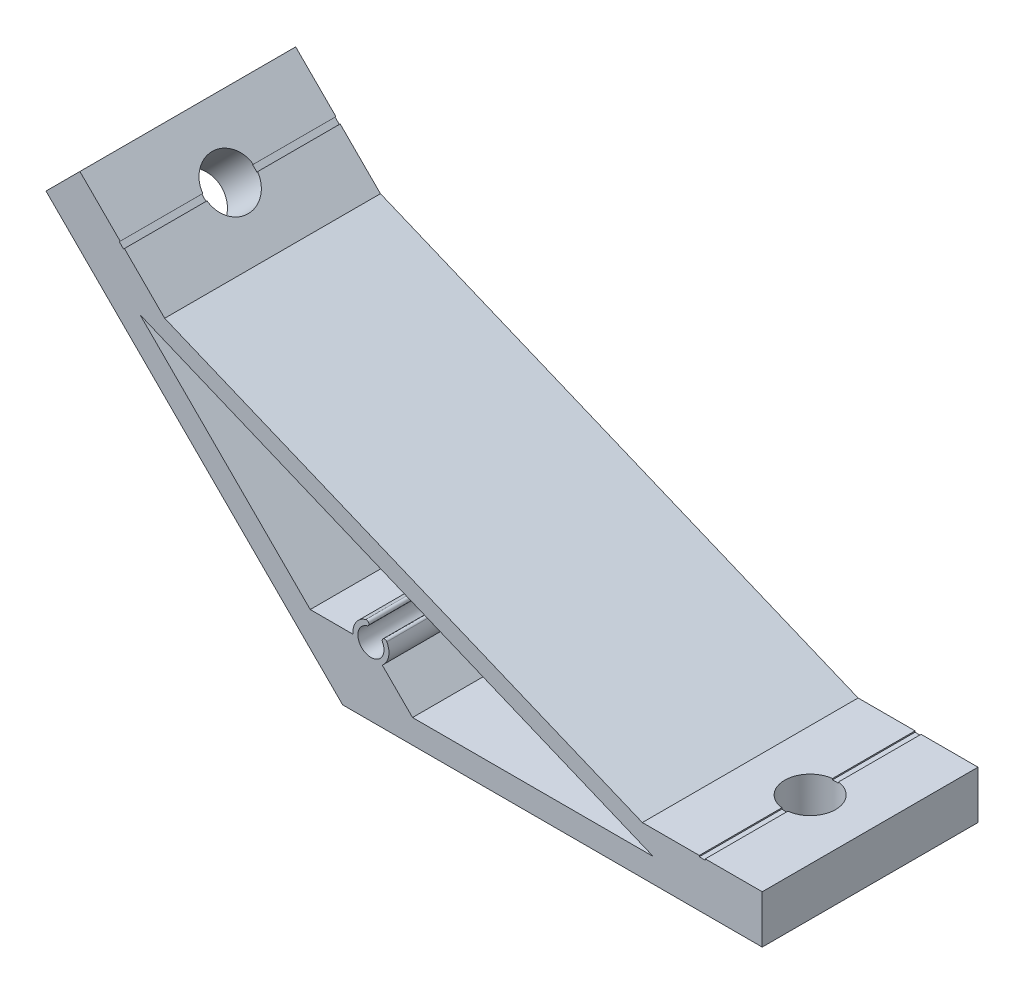
from build123d import *

# Parameters (mm, degrees)
EXTRUDE_1_DEPTH                 = 36
CUT_EXTRUDE_1_REACH             = 93.758
SKETCH_2_R                      = 4.25
CUT_EXTRUDE_2_REACH             = 90.803
SKETCH_3_R                      = 4.25
CUT_EXTRUDE_2_DIRECTION_2_DEPTH = 89.803380595
SKETCH_4_W                      = 1
SKETCH_4_H                      = 36
CUT_EXTRUDE_3_DEPTH             = 0.2
SKETCH_5_W                      = 36
SKETCH_5_H                      = 1
CUT_EXTRUDE_4_DEPTH             = 0.2


with BuildPart() as part:
    # 草图1 → 凸台-拉伸1 (new body)
    with BuildSketch(Plane.XY):
        Polygon((0, 0), (70, 0), (70, 8), (50, 8), (-29.69848481, 41.012193309), (-43.840620434, 55.154328933), (-49.497474683, 49.497474683), align=None)
        with BuildLine():
            Line((-33.812061864, 39.468916114), (-5.414213562, 11.071067812))
            Line((-5.414213562, 11.071067812), (1.735433814, 11.071067812))
            ThreePointArc((1.735433814, 11.071067812), (2.215643659, 13.045304249), (3.843807178, 14.260744318))
            ThreePointArc((3.843807178, 14.260744318), (4.355517598, 13.988067869), (4.08284115, 13.476357449))
            ThreePointArc((4.08284115, 13.476357449), (3.884071826, 9.376978879), (6.642219074, 12.416228401))
            ThreePointArc((6.642219074, 12.416228401), (6.811241616, 12.970873675), (7.365886891, 12.801851133))
            ThreePointArc((7.365886891, 12.801851133), (7.657726441, 10.791119753), (6.601290107, 9.055564143))
            Line((6.601290107, 9.055564143), (11.656854249, 4))
            Line((11.656854249, 4), (51.81747646, 4))
            Line((51.81747646, 4), (-33.812061864, 39.468916114))
        make_face(mode=Mode.SUBTRACT)
    extrude(amount=EXTRUDE_1_DEPTH)

    # 草图2 → 切除-拉伸1 (cut, up to next)
    with BuildSketch(Plane(origin=(0, 8, 0), x_dir=(1, 0, 0), z_dir=(0, 1, 0)), mode=Mode.PRIVATE) as cut_extrude_1_sk1:
        with Locations(Location((60, -18, 0), (0, 0, 270))):
            Circle(SKETCH_2_R)
    cut_extrude_1_tool1 = extrude(cut_extrude_1_sk1.sketch, amount=-CUT_EXTRUDE_1_REACH, mode=Mode.PRIVATE) & part.part
    add(cut_extrude_1_tool1.solids().sort_by_distance((60, 8, 18))[0], mode=Mode.SUBTRACT)

    # 草图3 → 切除-拉伸2 (cut, up to next)
    with BuildSketch(Plane(origin=(5.656854249, 5.656854249, 0), x_dir=(0, 0, -1), z_dir=(0.7071067811865437, 0.7071067811865513, 0)), mode=Mode.PRIVATE) as cut_extrude_2_sk1:
        with Locations(Location((-18, 60, 0), (0, 0, 270))):
            Circle(SKETCH_3_R)
    cut_extrude_2_tool1 = extrude(cut_extrude_2_sk1.sketch, amount=-CUT_EXTRUDE_2_REACH, mode=Mode.PRIVATE) & part.part
    add(cut_extrude_2_tool1.solids().sort_by_distance((-36.769553, 48.083261, 18))[0], mode=Mode.SUBTRACT)

    # 草图3 → 切除-拉伸2 direction 2 (cut)
    with BuildSketch(Plane(origin=(5.656854249, 5.656854249, 0), x_dir=(0, 0, -1), z_dir=(0.7071067811865437, 0.7071067811865513, 0))):
        with Locations(Location((-18, 60, 0), (0, 0, 270))):
            Circle(SKETCH_3_R)
    extrude(amount=CUT_EXTRUDE_2_DIRECTION_2_DEPTH, mode=Mode.SUBTRACT)

    # 草图4 → 切除-拉伸3 (cut)
    with BuildSketch(Plane(origin=(0, 8, 0), x_dir=(1, 0, 0), z_dir=(0, 1, 0))):
        with Locations((60, -18)):
            Rectangle(SKETCH_4_W, SKETCH_4_H)
    extrude(amount=-CUT_EXTRUDE_3_DEPTH, mode=Mode.SUBTRACT)

    # 草图5 → 切除-拉伸4 (cut)
    with BuildSketch(Plane(origin=(5.656854249, 5.656854249, 0), x_dir=(0, 0, -1), z_dir=(0.7071067811865437, 0.7071067811865513, 0))):
        with Locations((-18, 60)):
            Rectangle(SKETCH_5_W, SKETCH_5_H)
    extrude(amount=-CUT_EXTRUDE_4_DEPTH, mode=Mode.SUBTRACT)


solid = part.part
